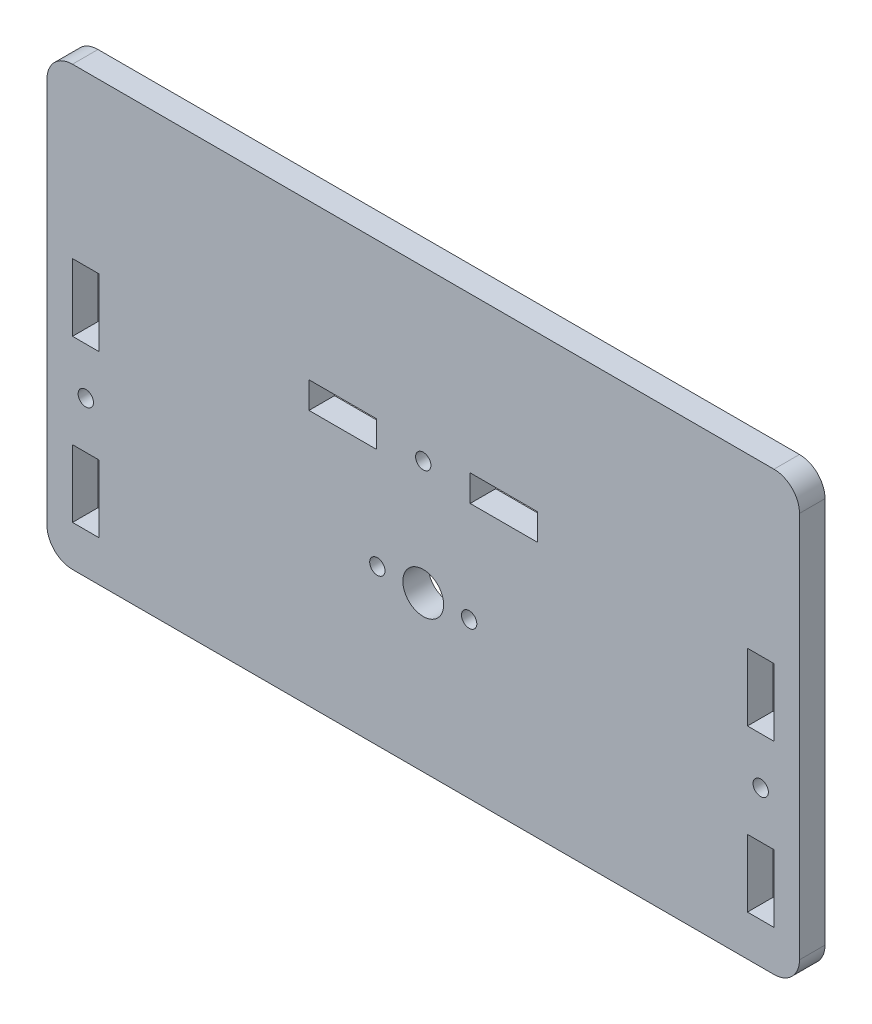
from build123d import *

# Parameters (mm, degrees)
SKETCH1_R           = 4
SKETCH1_R_2         = 1.5
SKETCH1_W           = 5.2
SKETCH1_H           = 13.2
SKETCH1_W_2         = 13.2
SKETCH1_H_2         = 5.2
BOSS_EXTRUDE1_DEPTH = 5


with BuildPart() as part:
    # Sketch1 → Boss-Extrude1 (new body)
    with BuildSketch(Plane.XY):
        with BuildLine():
            Line((-6.232072687, 97.310592398), (-143.765004629, 97.310592398))
            ThreePointArc((-143.765004629, 97.310592398), (-147.300538535, 95.846126304), (-148.765004629, 92.310592398))
            Line((-148.765004629, 92.310592398), (-148.765004629, 16.510592398))
            ThreePointArc((-148.765004629, 16.510592398), (-147.300538535, 12.975058492), (-143.765004629, 11.510592398))
            Line((-143.765004629, 11.510592398), (-6.232072687, 11.510592398))
            ThreePointArc((-6.232072687, 11.510592398), (-2.696538781, 12.975058492), (-1.232072687, 16.510592398))
            Line((-1.232072687, 16.510592398), (-1.232072687, 92.310592398))
            ThreePointArc((-1.232072687, 92.310592398), (-2.696538781, 95.846126304), (-6.232072687, 97.310592398))
        make_face()
        with Locations((-74.998538658, 41.910592398)):
            Circle(SKETCH1_R, mode=Mode.SUBTRACT)
        with Locations((-83.998538658, 41.910592398)):
            Circle(SKETCH1_R_2, mode=Mode.SUBTRACT)
        with Locations((-65.998538658, 41.910592398)):
            Circle(SKETCH1_R_2, mode=Mode.SUBTRACT)
        with Locations((-8.835038658, 41.910592398)):
            Circle(SKETCH1_R_2, mode=Mode.SUBTRACT)
        with Locations(Location((-141.162038658, 41.910592398, 0), (0, 0, 180))):
            Circle(SKETCH1_R_2, mode=Mode.SUBTRACT)
        with Locations((-74.998538658, 64.310592398)):
            Circle(SKETCH1_R_2, mode=Mode.SUBTRACT)
        with Locations((-8.835038658, 26.110592398)):
            Rectangle(SKETCH1_W, SKETCH1_H, mode=Mode.SUBTRACT)
        with Locations((-8.835038658, 57.710592398)):
            Rectangle(SKETCH1_W, SKETCH1_H, mode=Mode.SUBTRACT)
        with Locations((-59.198538658, 64.310592398)):
            Rectangle(SKETCH1_W_2, SKETCH1_H_2, mode=Mode.SUBTRACT)
        with Locations((-90.798538658, 64.310592398)):
            Rectangle(SKETCH1_W_2, SKETCH1_H_2, mode=Mode.SUBTRACT)
        with Locations((-141.162038658, 57.710592398)):
            Rectangle(SKETCH1_W, SKETCH1_H, mode=Mode.SUBTRACT)
        with Locations((-141.162038658, 26.110592398)):
            Rectangle(SKETCH1_W, SKETCH1_H, mode=Mode.SUBTRACT)
    extrude(amount=BOSS_EXTRUDE1_DEPTH)


solid = part.part
